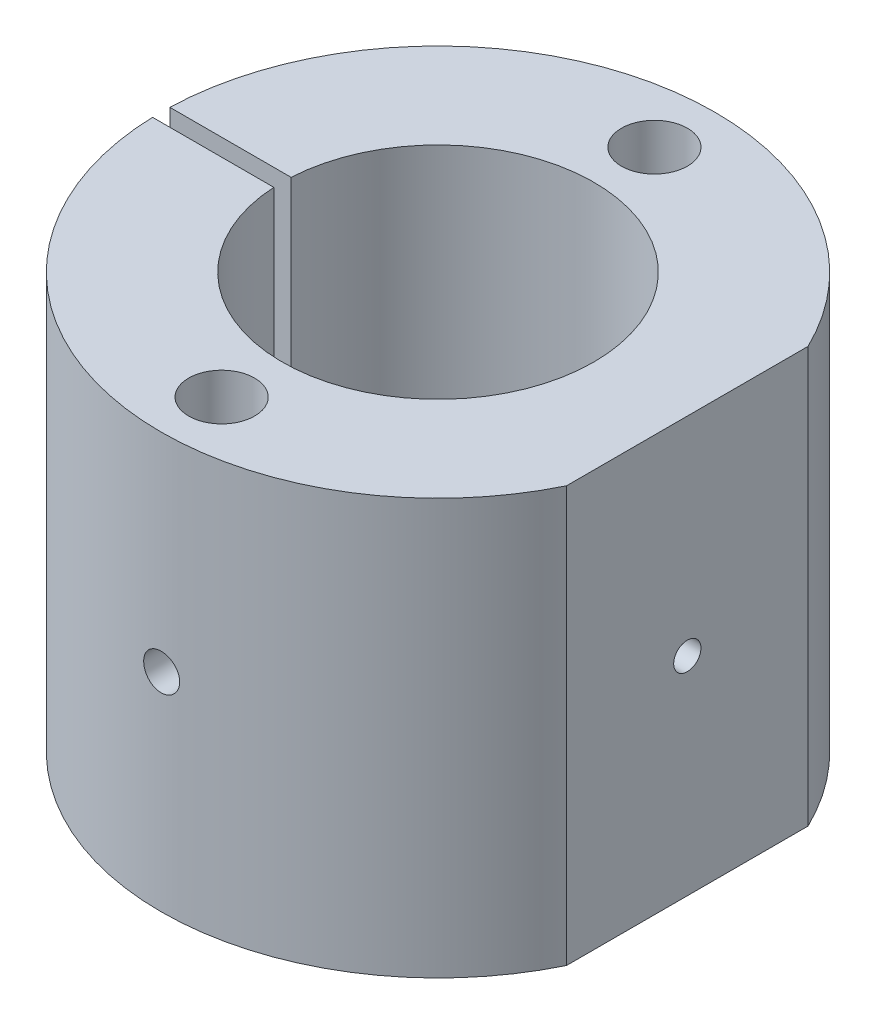
from build123d import *

# Parameters (mm, degrees)
SKETCH2_R                        = 25.4
SKETCH2_R_2                      = 14.2875
BOSS_EXTRUDE1_DEPTH              = 38.1
CUT_EXTRUDE1_REACH               = 54.363
SKETCH3_W                        = 25.4
SKETCH3_H                        = 1.5875
CUT_EXTRUDE2_REACH               = 54.363
SKETCH4_R                        = 3.0226
TAP_DRILL_FOR_M4X0_7_TAP1_REACH  = 61.824
TAP_DRILL_FOR_M4X0_7_TAP1_BORE_R = 1.65
CUT_EXTRUDE5_REACH               = 70.392
CUT_EXTRUDE5_END_RADIUS          = 3.0226
SKETCH11_R                       = 1.65
CUT_EXTRUDE6_REACH               = 54.363
TAP_DRILL_FOR_M3X0_5_TAP2_D      = 2.5
TAP_DRILL_FOR_M3X0_5_TAP2_DEPTH  = 4.572
TAP_DRILL_FOR_M3X0_5_TAP2_TIP    = 0.751075774
TAP_DRILL_FOR_M5X0_8_TAP1_REACH  = 55.583
TAP_DRILL_FOR_M5X0_8_TAP1_BORE_R = 2.1
SKETCH15_R                       = 2.665
CUT_EXTRUDE7_DEPTH               = 53.7470617
CUT_EXTRUDE8_REACH               = 59.143
SKETCH19_R                       = 5


with BuildPart() as part:
    # Sketch2 → Boss-Extrude1 (new body)
    with BuildSketch(Plane(origin=(0, 0, 0), x_dir=(1, 0, 0), z_dir=(0, 1, 0))):
        with Locations(Location((0, 0, 0), (0, 0, 90))):
            Circle(SKETCH2_R)
        with Locations(Location((0, 0, 0), (0, 0, 90))):
            Circle(SKETCH2_R_2, mode=Mode.SUBTRACT)
    extrude(amount=BOSS_EXTRUDE1_DEPTH)

    # Sketch3 → Cut-Extrude1 (cut, up to next)
    with BuildSketch(Plane(origin=(0, 38.1, 0), x_dir=(1, 0, 0), z_dir=(0, 1, 0)), mode=Mode.PRIVATE) as cut_extrude1_sk1:
        with Locations((-12.7, 0)):
            Rectangle(SKETCH3_W, SKETCH3_H)
    cut_extrude1_tool1 = extrude(cut_extrude1_sk1.sketch, amount=-CUT_EXTRUDE1_REACH, mode=Mode.PRIVATE) & part.part
    add(cut_extrude1_tool1.solids().sort_by_distance((-12.7, 38.1, 0))[0], mode=Mode.SUBTRACT)

    # Sketch4 → Cut-Extrude2 (cut, up to next)
    with BuildSketch(Plane(origin=(0, 38.1, 0), x_dir=(1, 0, 0), z_dir=(0, 1, 0)), mode=Mode.PRIVATE) as cut_extrude2_sk1:
        with Locations(Location((0, -19.84375, 0), (0, 0, 270))):
            Circle(SKETCH4_R)
    cut_extrude2_tool1 = extrude(cut_extrude2_sk1.sketch, amount=-CUT_EXTRUDE2_REACH, mode=Mode.PRIVATE) & part.part
    cut_extrude2 = cut_extrude2_tool1.solids().sort_by_distance((0, 38.1, 19.84375))[0]
    add(cut_extrude2, mode=Mode.SUBTRACT)

    # Tap Drill for M4x0.7 Tap1 bore (on position points) → Tap Drill for M4x0.7 Tap1 (cut, up to next)
    with BuildSketch(Plane(origin=(-19.826514488, 29.109235595, 0.79375), x_dir=(-1, 0, 0), z_dir=(0, 0, -1)), mode=Mode.PRIVATE) as tap_drill_for_m4x0_7_tap1_sk1:
        Circle(TAP_DRILL_FOR_M4X0_7_TAP1_BORE_R)
    tap_drill_for_m4x0_7_tap1_tool1 = extrude(tap_drill_for_m4x0_7_tap1_sk1.sketch, amount=-TAP_DRILL_FOR_M4X0_7_TAP1_REACH, mode=Mode.PRIVATE) & part.part
    # Tap Drill for M4x0.7 Tap1 bore (on position points) → Tap Drill for M4x0.7 Tap1 (cut, up to next)
    with BuildSketch(Plane(origin=(-19.826514488, 29.109235595, 0.79375), x_dir=(-1, 0, 0), z_dir=(0, 0, -1)), mode=Mode.PRIVATE) as tap_drill_for_m4x0_7_tap1_sk2:
        with Locations((0, -20.205281104)):
            Circle(TAP_DRILL_FOR_M4X0_7_TAP1_BORE_R)
    tap_drill_for_m4x0_7_tap1_tool2 = extrude(tap_drill_for_m4x0_7_tap1_sk2.sketch, amount=-TAP_DRILL_FOR_M4X0_7_TAP1_REACH, mode=Mode.PRIVATE) & part.part
    add(tap_drill_for_m4x0_7_tap1_tool1.solids().sort_by_distance((-19.826514, 29.109236, 0.79375))[0], mode=Mode.SUBTRACT)
    add(tap_drill_for_m4x0_7_tap1_tool2.solids().sort_by_distance((-19.826514, 8.903954, 0.79375))[0], mode=Mode.SUBTRACT)

    # Cut-Extrude5: up to this cylinder (the profile starts outside it)
    cut_extrude5_end = Plane(origin=(0, 19.05, 19.84375), z_dir=(0, 1, 0)) * Cylinder(CUT_EXTRUDE5_END_RADIUS, 147.8292, mode=Mode.PRIVATE)
    # Sketch11 → Cut-Extrude5 (cut, up to the surface)
    with BuildSketch(Plane.XY.offset(25.4), mode=Mode.PRIVATE) as cut_extrude5_sk1:
        with Locations((0.006202687, 19.05)):
            Circle(SKETCH11_R)
    cut_extrude5_tool1 = extrude(cut_extrude5_sk1.sketch, amount=-CUT_EXTRUDE5_REACH, mode=Mode.PRIVATE) - cut_extrude5_end
    cut_extrude5 = cut_extrude5_tool1.solids().sort_by_distance((0.006203, 19.05, 25.4))[0]
    add(cut_extrude5, mode=Mode.SUBTRACT)

    # Mirror1: Cut-Extrude2, Cut-Extrude5 across plane
    add(cut_extrude2.mirror(Plane.XY), mode=Mode.SUBTRACT)
    add(cut_extrude5.mirror(Plane.XY), mode=Mode.SUBTRACT)

    # Sketch12 → Cut-Extrude6 (cut, up to next)
    with BuildSketch(Plane(origin=(0, 38.1, 0), x_dir=(1, 0, 0), z_dir=(0, 1, 0)), mode=Mode.PRIVATE) as cut_extrude6_sk1:
        with BuildLine():
            Line((22.86, 11.071603317), (22.86, -11.071603317))
            ThreePointArc((22.86, -11.071603317), (25.4, 0), (22.86, 11.071603317))
        make_face()
    cut_extrude6_tool1 = extrude(cut_extrude6_sk1.sketch, amount=-CUT_EXTRUDE6_REACH, mode=Mode.PRIVATE) & part.part
    add(cut_extrude6_tool1.solids().sort_by_distance((23.880484, 38.1, 0))[0], mode=Mode.SUBTRACT)

    # Tap Drill for M3x0.5 Tap2
    with Locations(Plane(origin=(22.86, 19.05, 0), x_dir=(0, 0, 1), z_dir=(1, 0, 0))):
        with Locations((0, 0)):
            Hole(TAP_DRILL_FOR_M3X0_5_TAP2_D / 2, depth=TAP_DRILL_FOR_M3X0_5_TAP2_DEPTH)
            with Locations((0, 0, -(TAP_DRILL_FOR_M3X0_5_TAP2_DEPTH + TAP_DRILL_FOR_M3X0_5_TAP2_TIP / 2))):  # 118° drill point
                Cone(0, TAP_DRILL_FOR_M3X0_5_TAP2_D / 2, TAP_DRILL_FOR_M3X0_5_TAP2_TIP, mode=Mode.SUBTRACT)

    # Tap Drill for M5x0.8 Tap1 bore (on position points) → Tap Drill for M5x0.8 Tap1 (cut, up to next)
    with BuildSketch(Plane(origin=(-19.826514488, 19.05, 0.79375), x_dir=(-1, 0, 0), z_dir=(0, 0, -1)), mode=Mode.PRIVATE) as tap_drill_for_m5x0_8_tap1_sk1:
        Circle(TAP_DRILL_FOR_M5X0_8_TAP1_BORE_R)
    tap_drill_for_m5x0_8_tap1_tool1 = extrude(tap_drill_for_m5x0_8_tap1_sk1.sketch, amount=-TAP_DRILL_FOR_M5X0_8_TAP1_REACH, mode=Mode.PRIVATE) & part.part
    add(tap_drill_for_m5x0_8_tap1_tool1.solids().sort_by_distance((-19.826514, 19.05, 0.79375))[0], mode=Mode.SUBTRACT)

    # Sketch15 → Cut-Extrude7 (cut, through all)
    with BuildSketch(Plane(origin=(0, 0, 0.79375), x_dir=(-1, 0, 0), z_dir=(0, 0, -1))):
        with Locations(Location((19.826514488, 19.05, 0), (0, 0, 180))):
            Circle(SKETCH15_R)
    extrude(amount=CUT_EXTRUDE7_DEPTH, mode=Mode.SUBTRACT)

    # Sketch19 → Cut-Extrude8 (cut, up to next)
    with BuildSketch(Plane.XY.offset(-8.79375), mode=Mode.PRIVATE) as cut_extrude8_sk1:
        with Locations((-19.826514488, 19.05)):
            Circle(SKETCH19_R)
    cut_extrude8_tool1 = extrude(cut_extrude8_sk1.sketch, amount=-CUT_EXTRUDE8_REACH, mode=Mode.PRIVATE) & part.part
    add(cut_extrude8_tool1.solids().sort_by_distance((-19.826514, 19.05, -8.79375))[0], mode=Mode.SUBTRACT)


solid = part.part
